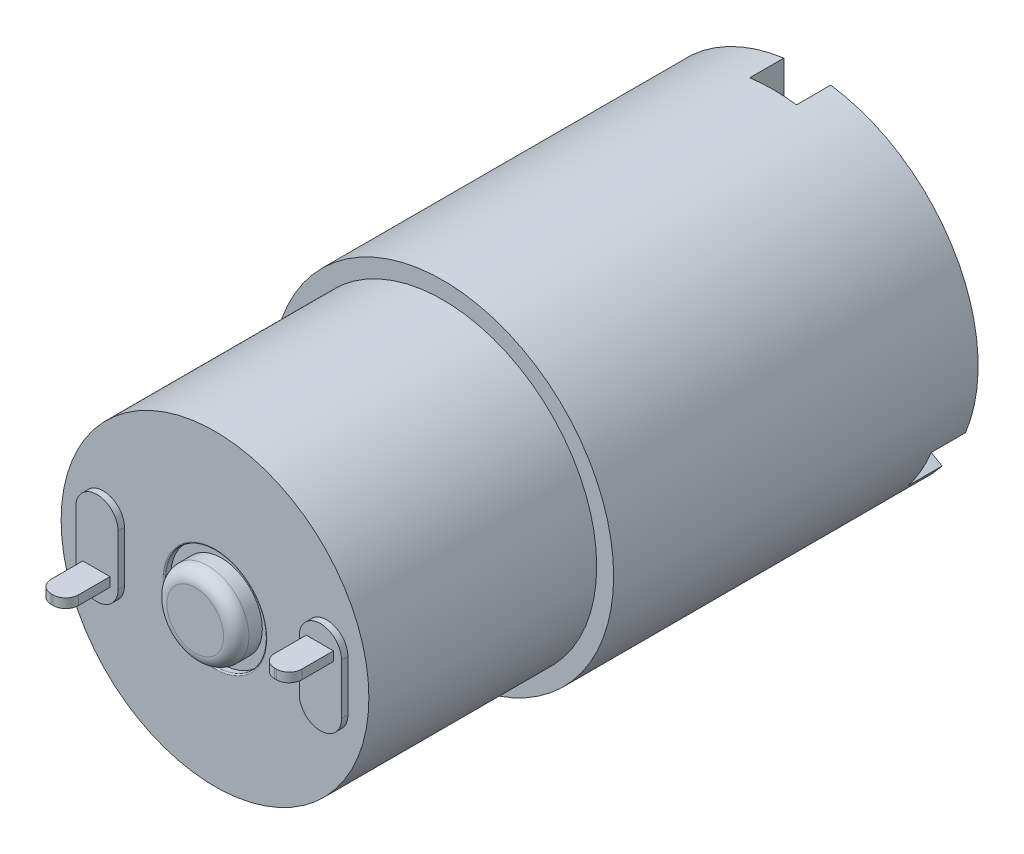
from build123d import *

# Parameters (mm, degrees)
SKETCH_1_R             = 13.5
EXTRUDE_1_DEPTH        = 28.8
SKETCH_2_R             = 12.16
EXTRUDE_2_DEPTH        = 18
SKETCH_3_R             = 4
CUT_EXTRUDE_1_DEPTH    = 0.5
SKETCH_4_R             = 3.24
EXTRUDE_3_DEPTH        = 2.06
FILLET_1_R             = 0.1
FILLET_2_R             = 1
EXTRUDE_4_DEPTH        = 0.5
SKETCH_6_W             = 2.145218315
SKETCH_6_H             = 0.731898013
SKETCH_6_W_2           = 2.145218314
SKETCH_6_H_2           = 0.731898014
EXTRUDE_5_DEPTH        = 3.5
FILLET_3_R             = 1
CUT_EXTRUDE_2_DEPTH    = 2.7
PATTERN_LINEAR_1_COUNT = 2
PATTERN_LINEAR_1_PITCH = 9
SKETCH_10_R            = 0.323097308
CUT_EXTRUDE_3_DEPTH    = 2.7
SKETCH_13_R            = 0.255477279
CUT_EXTRUDE_4_DEPTH    = 2.7
CUT_EXTRUDE_5_DEPTH    = 2


with BuildPart() as part:
    # 草图1 → 凸台-拉伸1 (new body)
    with BuildSketch(Plane.XY):
        Circle(SKETCH_1_R)
    extrude(amount=EXTRUDE_1_DEPTH)

    # 草图2 → 凸台-拉伸2 (add)
    with BuildSketch(Plane.XY.offset(28.8)):
        Circle(SKETCH_2_R)
    extrude(amount=EXTRUDE_2_DEPTH)

    # 草图3 → 切除-拉伸1 (cut)
    with BuildSketch(Plane.XY.offset(46.8)):
        Circle(SKETCH_3_R)
    extrude(amount=-CUT_EXTRUDE_1_DEPTH, mode=Mode.SUBTRACT)

    # 草图4 → 凸台-拉伸3 (add)
    with BuildSketch(Plane.XY.offset(46.3)):
        Circle(SKETCH_4_R)
    extrude(amount=EXTRUDE_3_DEPTH)

    # 圆角1
    fillet_1_edges = [part.edges().sort_by_distance(p)[0] for p in [
        (-4, 0, 46.8),
    ]]
    fillet(fillet_1_edges, radius=FILLET_1_R)

    # 圆角2
    fillet_2_edges = [part.edges().sort_by_distance(p)[0] for p in [
        (-3.24, 0, 48.36),
    ]]
    fillet(fillet_2_edges, radius=FILLET_2_R)

    # 草图5 → 凸台-拉伸4 (add)
    with BuildSketch(Plane.XY.offset(46.8)):
        with BuildLine():
            Line((-7.16, 2), (-7.16, -2))
            ThreePointArc((-7.16, -2), (-8.83, -3.67), (-10.5, -2))
            Line((-10.5, -2), (-10.5, 2))
            ThreePointArc((-10.5, 2), (-8.83, 3.67), (-7.16, 2))
        make_face()
        with BuildLine():
            Line((7.16, 2), (7.16, -2))
            ThreePointArc((7.16, -2), (8.83, -3.67), (10.5, -2))
            Line((10.5, -2), (10.5, 2))
            ThreePointArc((10.5, 2), (8.83, 3.67), (7.16, 2))
        make_face()
    extrude(amount=EXTRUDE_4_DEPTH)

    # 草图6 → 凸台-拉伸5 (add)
    with BuildSketch(Plane.XY.offset(47.3)):
        with Locations((-8.86959666, -1.801422961)):
            Rectangle(SKETCH_6_W, SKETCH_6_H)
        with Locations((8.784288178, 1.946399625)):
            Rectangle(SKETCH_6_W_2, SKETCH_6_H_2)
    extrude(amount=EXTRUDE_5_DEPTH)

    # 圆角3
    fillet_3_edges = [part.edges().sort_by_distance(p)[0] for p in [
        (7.711679021, 1.946399625, 50.8),
        (9.856897335, 1.946399625, 50.8),
        (-9.942205817, -1.80142296, 50.8),
        (-7.796987502, -1.80142296, 50.8),
    ]]
    fillet(fillet_3_edges, radius=FILLET_3_R)

    # 草图7 → 切除-拉伸2 (cut)
    with BuildSketch(Plane(origin=(0, 0, 0), x_dir=(-1, 0, 0), z_dir=(0, 0, -1))):
        with BuildLine():
            Line((1.85, 16), (1.85, 11))
            ThreePointArc((1.85, 11), (0, 9.15), (-1.85, 11))
            Line((-1.85, 11), (-1.85, 16))
            ThreePointArc((-1.85, 16), (0, 17.85), (1.85, 16))
        make_face()
        with BuildLine():
            Line((12.931406461, -9.602146997), (8.601279442, -7.102146997))
            ThreePointArc((8.601279442, -7.102146997), (7.924132445, -4.575), (10.451279442, -3.897853003))
            Line((10.451279442, -3.897853003), (14.781406461, -6.397853003))
            ThreePointArc((14.781406461, -6.397853003), (15.458553458, -8.925), (12.931406461, -9.602146997))
        make_face()
        with BuildLine():
            Line((-14.781406461, -6.397853003), (-10.451279442, -3.897853003))
            ThreePointArc((-10.451279442, -3.897853003), (-7.924132445, -4.575), (-8.601279442, -7.102146997))
            Line((-8.601279442, -7.102146997), (-12.931406461, -9.602146997))
            ThreePointArc((-12.931406461, -9.602146997), (-15.458553458, -8.925), (-14.781406461, -6.397853003))
        make_face()
    extrude(amount=-CUT_EXTRUDE_2_DEPTH, mode=Mode.SUBTRACT)

    # 草图9 → 旋转1 (revolve)
    with BuildSketch(Plane(origin=(0, 0, 0), x_dir=(1, 0, 0), z_dir=(0, 1, 0))):
        Polygon((0, 7), (0, 0), (-2.905653035, 0), (-2, 0.905653035), (-2, 3.949637413), (-0.890685833, 5.05895158), (-2, 5.05895158), (-2, 5.636365699), (-0.636365699, 7), align=None)
    revolve_1 = revolve(axis=Axis((0, 0, -8.873463159), (0, 0, 1)))

    # 阵列(线性)1: 旋转1 ×2
    with Locations(*[(0, -i * PATTERN_LINEAR_1_PITCH, 0) for i in range(1, PATTERN_LINEAR_1_COUNT)]):
        add(revolve_1)

    # 草图10 → 切除-拉伸3 (cut)
    with BuildSketch(Plane(origin=(0, 0, -7), x_dir=(-1, 0, 0), z_dir=(0, 0, -1))):
        Circle(SKETCH_10_R)
    extrude(amount=-CUT_EXTRUDE_3_DEPTH, mode=Mode.SUBTRACT)

    # 草图13 → 切除-拉伸4 (cut)
    with BuildSketch(Plane(origin=(0, 0, -7), x_dir=(-1, 0, 0), z_dir=(0, 0, -1))):
        with Locations((0, -9)):
            Circle(SKETCH_13_R)
    extrude(amount=-CUT_EXTRUDE_4_DEPTH, mode=Mode.SUBTRACT)

    # 草图14 → 切除-拉伸5 (cut)
    with BuildSketch(Plane(origin=(0, 0, 0), x_dir=(-1, 0, 0), z_dir=(0, 0, -1))):
        with BuildLine():
            Line((-0.52608989, 4.972245914), (-0.52608989, 3.431742925))
            ThreePointArc((-0.52608989, 3.431742925), (0, 2.905653035), (0.52608989, 3.431742925))
            Line((0.52608989, 3.431742925), (0.52608989, 4.972245914))
            ThreePointArc((0.52608989, 4.972245914), (2.219187285, 4.480536552), (3.636363636, 3.431742925))
            ThreePointArc((3.636363636, 3.431742925), (4.343174293, 3.411280854), (4.363636364, 4.11809151))
            ThreePointArc((4.363636364, 4.11809151), (0, 6), (-4.363636364, 4.11809151))
            ThreePointArc((-4.363636364, 4.11809151), (-4.343174293, 3.411280854), (-3.636363636, 3.431742925))
            ThreePointArc((-3.636363636, 3.431742925), (-2.219187285, 4.480536552), (-0.52608989, 4.972245914))
        make_face()
        with BuildLine():
            Line((2.708931608, -2.171478672), (4.04304633, -2.941730166))
            ThreePointArc((4.04304633, -2.941730166), (2.770664835, -4.16214084), (1.153794734, -4.865054749))
            ThreePointArc((1.153794734, -4.865054749), (0.782668733, -5.466939697), (1.384553681, -5.838065699))
            ThreePointArc((1.384553681, -5.838065699), (5.196152423, -3), (5.748190045, 1.719974189))
            ThreePointArc((5.748190045, 1.719974189), (5.125843025, 2.055658843), (4.790158371, 1.433311824))
            ThreePointArc((4.790158371, 1.433311824), (4.989852119, -0.318395712), (4.56913622, -2.030515748))
            Line((4.56913622, -2.030515748), (3.235021497, -1.260264253))
            ThreePointArc((3.235021497, -1.260264253), (2.516369343, -1.452826518), (2.708931608, -2.171478672))
        make_face()
        with BuildLine():
            Line((-3.235021497, -1.260264253), (-4.56913622, -2.030515748))
            ThreePointArc((-4.56913622, -2.030515748), (-4.989852119, -0.318395712), (-4.790158371, 1.433311824))
            ThreePointArc((-4.790158371, 1.433311824), (-5.125843025, 2.055658843), (-5.748190045, 1.719974189))
            ThreePointArc((-5.748190045, 1.719974189), (-5.196152423, -3), (-1.384553681, -5.838065699))
            ThreePointArc((-1.384553681, -5.838065699), (-0.782668733, -5.466939697), (-1.153794734, -4.865054749))
            ThreePointArc((-1.153794734, -4.865054749), (-2.770664835, -4.16214084), (-4.04304633, -2.941730166))
            Line((-4.04304633, -2.941730166), (-2.708931608, -2.171478672))
            ThreePointArc((-2.708931608, -2.171478672), (-2.516369343, -1.452826518), (-3.235021497, -1.260264253))
        make_face()
    extrude(amount=-CUT_EXTRUDE_5_DEPTH, mode=Mode.SUBTRACT)


solid = part.part
